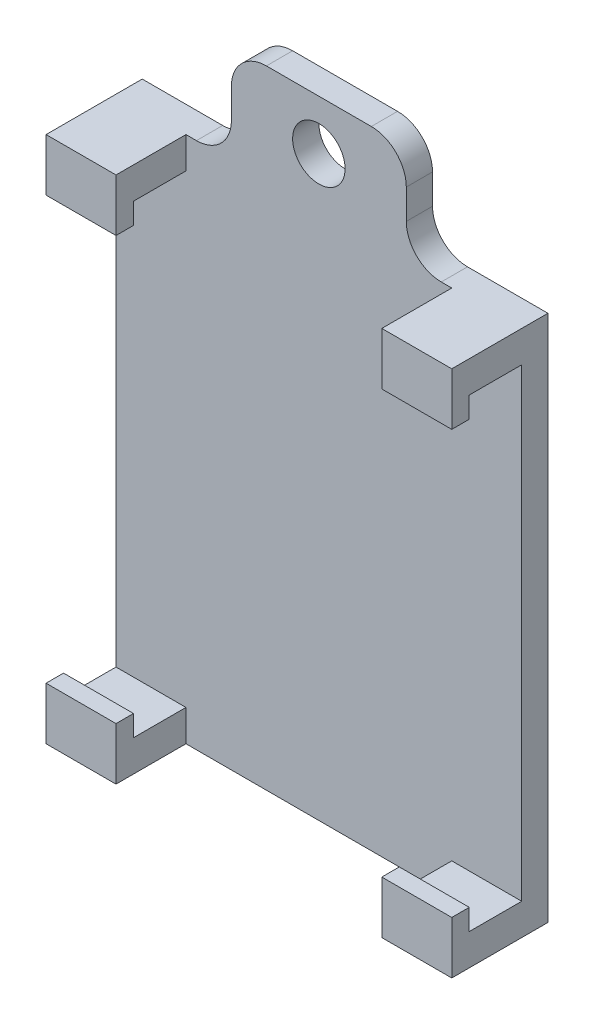
from build123d import *

# Parameters (mm, degrees)
SKETCH1_W             = 23.2
SKETCH1_H             = 41.57
BOSS_EXTRUDE1_DEPTH   = 1.5
SKETCH2_W             = 23.2
SKETCH2_H             = 3
BOSS_EXTRUDE2_DEPTH   = 4
SKETCH3_W             = 23.2
SKETCH3_H             = 3
CUT_EXTRUDE1_DEPTH    = 1.2
SKETCH4_W             = 23.2
SKETCH4_H             = 3
CUT_EXTRUDE2_DEPTH    = 1.2
SKETCH5_R             = 1.5
CUT_EXTRUDE3_DEPTH    = 48.773474858
SKETCH7_W             = 23.2
SKETCH7_H             = 5.7
CUT_EXTRUDE4_DEPTH    = 48.922384123
SKETCH8_W             = 15.2
SKETCH8_H             = 4
CUT_EXTRUDE5_DEPTH    = 44.071416276
SKETCH9_W             = 6.6
SKETCH9_H             = 5.7
CUT_EXTRUDE6_DEPTH    = 48.773474858
FILLET1_R             = 2
BODY_MOVE_COPY1_ANGLE = 90


with BuildPart() as part:
    # Sketch1 → Boss-Extrude1 (new body)
    with BuildSketch(Plane(origin=(0, 0, 0), x_dir=(1, 0, 0), z_dir=(0, 1, 0))):
        with Locations((11.6, 20.785)):
            Rectangle(SKETCH1_W, SKETCH1_H)
    extrude(amount=BOSS_EXTRUDE1_DEPTH)

    # Sketch2 → Boss-Extrude2 (add)
    with BuildSketch(Plane(origin=(0, 1.5, 0), x_dir=(1, 0, 0), z_dir=(0, 1, 0))):
        with Locations((11.6, 34.37)):
            Rectangle(SKETCH2_W, SKETCH2_H)
        with Locations((11.6, 7.2)):
            Rectangle(SKETCH2_W, SKETCH2_H)
    extrude(amount=BOSS_EXTRUDE2_DEPTH)

    # Sketch3 → Cut-Extrude1 (cut)
    with BuildSketch(Plane.XY.offset(-32.87)):
        with Locations((11.6, 3)):
            Rectangle(SKETCH3_W, SKETCH3_H)
    extrude(amount=-CUT_EXTRUDE1_DEPTH, mode=Mode.SUBTRACT)

    # Sketch4 → Cut-Extrude2 (cut)
    with BuildSketch(Plane(origin=(0, 0, -8.7), x_dir=(-1, 0, 0), z_dir=(0, 0, -1))):
        with Locations((-11.6, 3)):
            Rectangle(SKETCH4_W, SKETCH4_H)
    extrude(amount=-CUT_EXTRUDE2_DEPTH, mode=Mode.SUBTRACT)

    # Sketch5 → Cut-Extrude3 (cut, through all)
    with BuildSketch(Plane(origin=(0, 1.5, 0), x_dir=(1, 0, 0), z_dir=(0, 1, 0))):
        with Locations(Location((11.6, 38.72, 0), (0, 0, 270))):
            Circle(SKETCH5_R)
        with Locations(Location((11.6, 2.85, 0), (0, 0, 270))):
            Circle(SKETCH5_R)
    extrude(amount=-CUT_EXTRUDE3_DEPTH, mode=Mode.SUBTRACT)

    # Sketch7 → Cut-Extrude4 (cut, through all)
    with BuildSketch(Plane(origin=(0, 0, 0), x_dir=(1, 0, 0), z_dir=(0, 1, 0))):
        with Locations((11.6, 2.85)):
            Rectangle(SKETCH7_W, SKETCH7_H)
    extrude(amount=CUT_EXTRUDE4_DEPTH, mode=Mode.SUBTRACT)

    # Sketch8 → Cut-Extrude5 (cut, through all)
    with BuildSketch(Plane.XY.offset(-5.7)):
        with Locations((11.6, 3.5)):
            Rectangle(SKETCH8_W, SKETCH8_H)
    extrude(amount=-CUT_EXTRUDE5_DEPTH, mode=Mode.SUBTRACT)

    # Sketch9 → Cut-Extrude6 (cut, through all)
    with BuildSketch(Plane(origin=(0, 1.5, 0), x_dir=(1, 0, 0), z_dir=(0, 1, 0))):
        with Locations((3.3, 38.72)):
            Rectangle(SKETCH9_W, SKETCH9_H)
        with Locations((19.9, 38.72)):
            Rectangle(SKETCH9_W, SKETCH9_H)
    extrude(amount=-CUT_EXTRUDE6_DEPTH, mode=Mode.SUBTRACT)

    # Fillet1
    fillet1_edges = [part.edges().sort_by_distance(p)[0] for p in [
        (6.6, 0.75, -41.57),
        (6.6, 0.75, -35.87),
        (16.6, 0.75, -41.57),
        (16.6, 0.75, -35.87),
    ]]
    fillet(fillet1_edges, radius=FILLET1_R)


with BuildPart() as part_1:
    # Body-Move/Copy1: moved
    add(part.part.rotate(Axis((0, 2.75, -20.7), (1, 0, 0)), BODY_MOVE_COPY1_ANGLE))


solid = part_1.part
